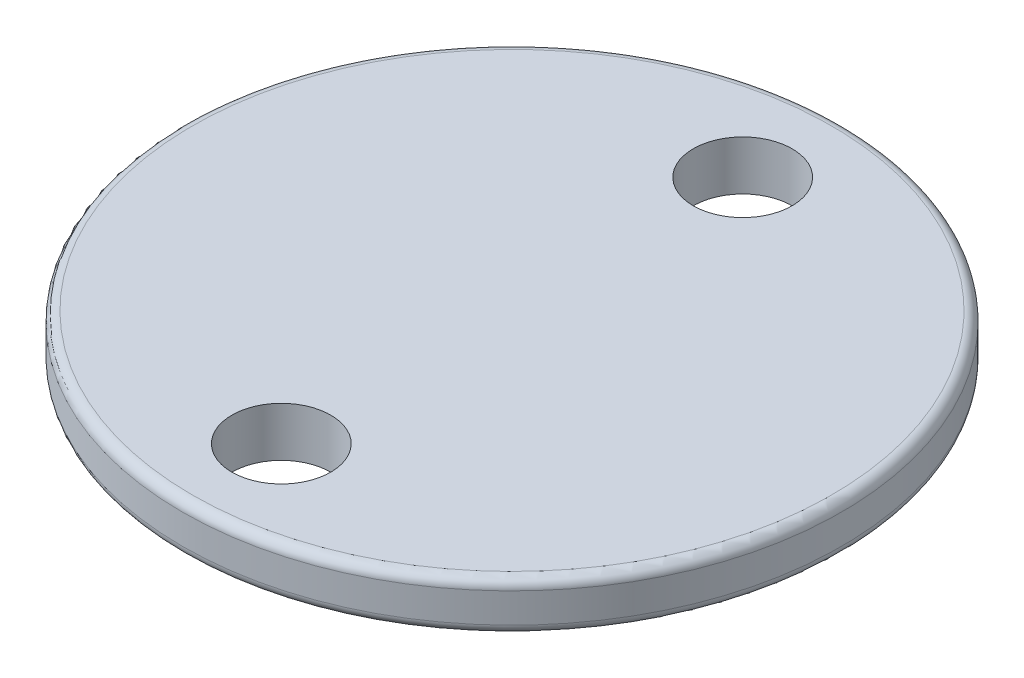
from build123d import *

# Parameters (mm, degrees)
SKETCH_1_R      = 10
SKETCH_1_R_2    = 1.5
EXTRUDE_1_DEPTH = 1.5
FILLET_1_R      = 0.3


with BuildPart() as part:
    # 草图1 → 凸台-拉伸1 (new body)
    with BuildSketch(Plane(origin=(0, 0, 0), x_dir=(1, 0, 0), z_dir=(0, 1, 0))):
        with Locations(Location((0, 0, 0), (0, 0, 270))):
            Circle(SKETCH_1_R)
        with Locations(Location((0, 7, 0), (0, 0, 270))):
            Circle(SKETCH_1_R_2, mode=Mode.SUBTRACT)
        with Locations(Location((0, -7, 0), (0, 0, 270))):
            Circle(SKETCH_1_R_2, mode=Mode.SUBTRACT)
    extrude(amount=EXTRUDE_1_DEPTH)

    # 圆角1
    fillet_1_edges = [part.edges().sort_by_distance(p)[0] for p in [
        (0, 0, -10),
        (0, 1.5, -10),
    ]]
    fillet(fillet_1_edges, radius=FILLET_1_R)


solid = part.part
